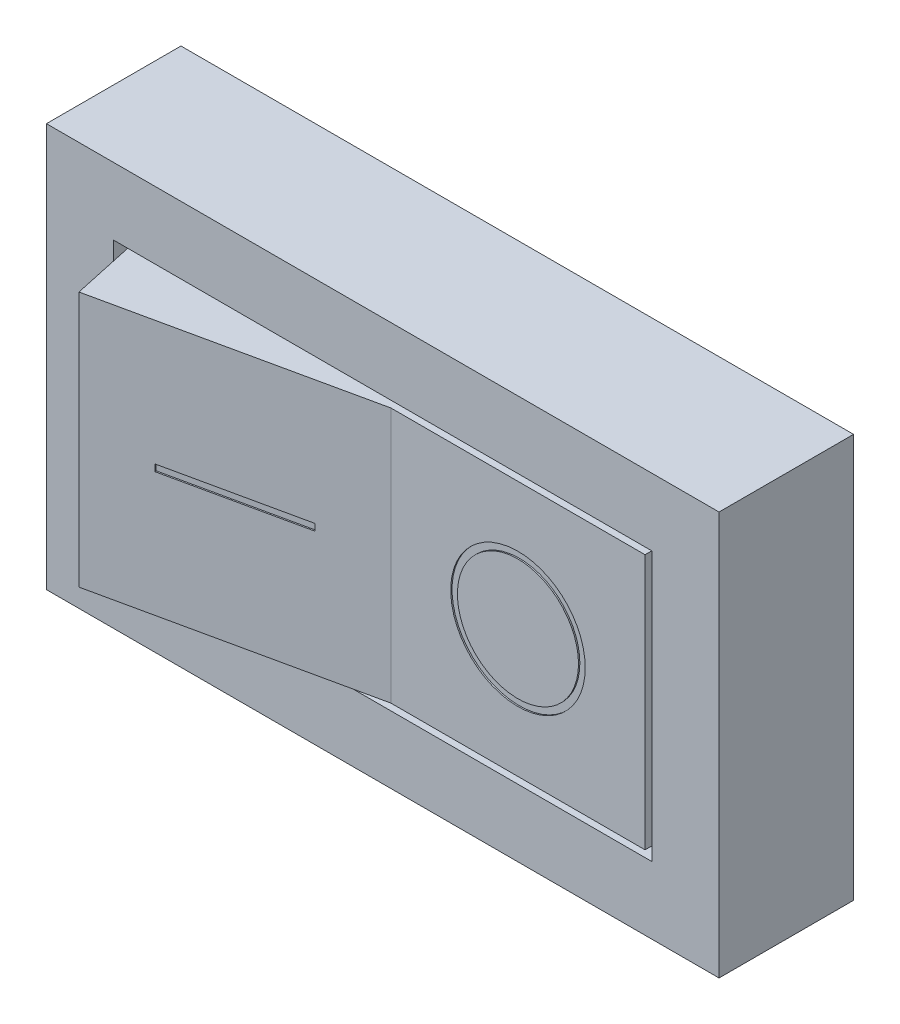
from build123d import *

# Parameters (mm, degrees)
SKETCH1_W           = 50
SKETCH1_H           = 30
SKETCH1_W_2         = 40
SKETCH1_H_2         = 20
EXTRUDE_THIN2_DEPTH = 10
SKETCH2_W           = 20
SKETCH2_H           = 19
BOSS_EXTRUDE1_DEPTH = 5
CUT_EXTRUDE1_DEPTH  = 19
SKETCH6_W           = 5.115875382
SKETCH6_H           = 19
BOSS_EXTRUDE2_DEPTH = 19.5
SKETCH7_R           = 5
SKETCH7_R_2         = 4.5
CUT_EXTRUDE3_DEPTH  = 0.1
SKETCH9_W           = 10
SKETCH9_H           = 0.5
CUT_EXTRUDE4_DEPTH  = 0.1


with BuildPart() as part:
    # Sketch1 → Extrude-Thin2 (new body)
    with BuildSketch(Plane.XY):
        with Locations((0.641550344, 0.974061664)):
            Rectangle(SKETCH1_W, SKETCH1_H)
        with Locations((0.641550344, 0.974061664)):
            Rectangle(SKETCH1_W_2, SKETCH1_H_2, mode=Mode.SUBTRACT)
    extrude(amount=EXTRUDE_THIN2_DEPTH)


with BuildPart() as body_2:
    # Sketch2 → Boss-Extrude1 (new body)
    with BuildSketch(Plane.XY.offset(5)):
        with Locations((10.141550344, 0.974061664)):
            Rectangle(SKETCH2_W, SKETCH2_H)
    extrude(amount=BOSS_EXTRUDE1_DEPTH)

    # Sketch3 → Cut-Extrude1 (cut)
    with BuildSketch(Plane.XZ.offset(8.525938336)):
        Polygon((0.141550344, 4.898701044), (1.246158119, 10), (0.141550344, 10), align=None)
    extrude(amount=-CUT_EXTRUDE1_DEPTH, mode=Mode.SUBTRACT)

    # Sketch6 → Boss-Extrude2 (add)
    with BuildSketch(Plane(origin=(-0.878020037, 0, 0.190121725), x_dir=(0.21163006596186237, 0, 0.9773498427794307), z_dir=(-0.9773498427794306, 0, 0.21163006596186235))):
        with Locations((7.479285262, 0.974061664)):
            Rectangle(SKETCH6_W, SKETCH6_H)
    extrude(amount=BOSS_EXTRUDE2_DEPTH)

    # Sketch7 → Cut-Extrude3 (cut)
    with BuildSketch(Plane.XY.offset(10)):
        with Locations((10.693854232, 0.974061664)):
            Circle(SKETCH7_R)
        with Locations((10.693854232, 0.974061664)):
            Circle(SKETCH7_R_2, mode=Mode.SUBTRACT)
    extrude(amount=-CUT_EXTRUDE3_DEPTH, mode=Mode.SUBTRACT)

    # Sketch9 → Cut-Extrude4 (cut)
    with BuildSketch(Plane(origin=(2.124178156, 0, 9.809878275), x_dir=(0.9773498427794307, 0, -0.21163006596186243), z_dir=(0.21163006596186243, 0, 0.9773498427794307))):
        with Locations((-10.648368218, 0.974061664)):
            Rectangle(SKETCH9_W, SKETCH9_H)
    extrude(amount=-CUT_EXTRUDE4_DEPTH, mode=Mode.SUBTRACT)


solid = Compound([part.part, body_2.part])
